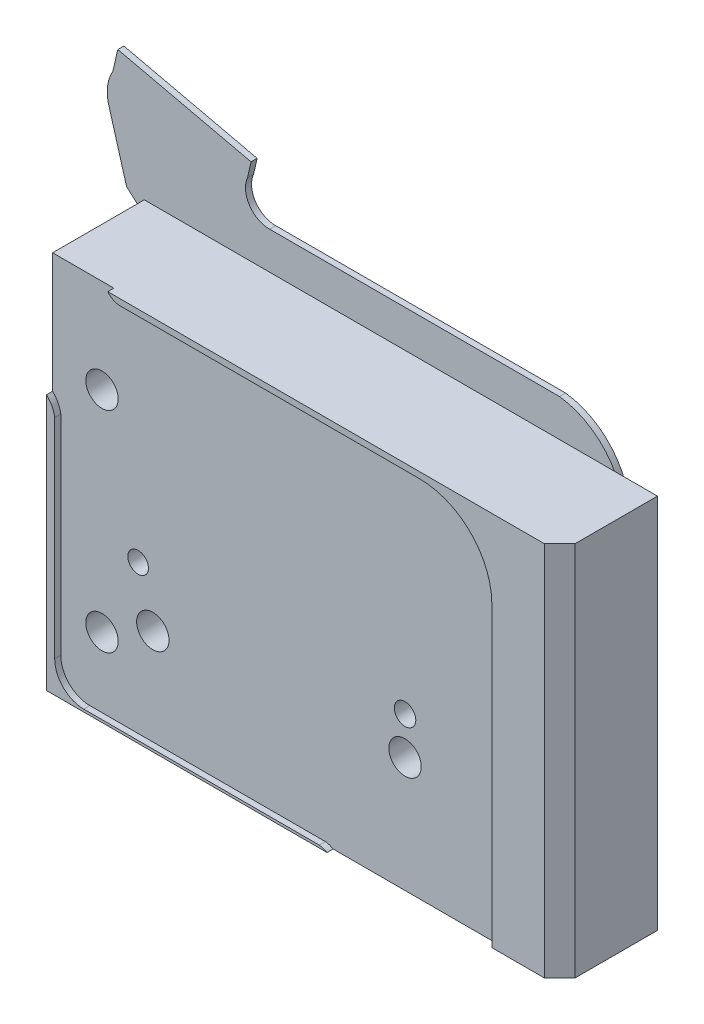
from build123d import *

# Parameters (mm, degrees)
CROQUIS1_R              = 4.430496459
CROQUIS1_R_2            = 2.021537648
CROQUIS1_R_3            = 2.872174668
CROQUIS1_R_4            = 2.680697474
CROQUIS1_R_5            = 2.776444448
CROQUIS1_R_6            = 2.106249137
CROQUIS1_R_7            = 2.790383016
SALIENTE_EXTRUIR1_DEPTH = 1.19
CROQUIS7_W              = 102.52
CROQUIS7_H              = 77.67
SALIENTE_EXTRUIR2_DEPTH = 19.15
CROQUIS8_R              = 2.021537648
CROQUIS8_R_2            = 3.175
CROQUIS8_R_3            = 2.106249137
CORTAR_EXTRUIR3_DEPTH   = 3107.825691909
CROQUIS8_7_R            = 2.856101073
CROQUIS8_7_R_2          = 2.872174668
CORTAR_EXTRUIR4_DEPTH   = 19.15
CROQUIS12_R             = 2.872174668
CROQUIS12_R_2           = 2.856101073
SALIENTE_EXTRUIR3_DEPTH = 7
CORTAR_EXTRUIR8_START   = -1.19
CROQUIS13_R             = 2.856101073
CROQUIS13_R_2           = 2.021537648
CROQUIS13_R_3           = 3.175
CROQUIS13_R_4           = 2.106249137
CROQUIS13_R_5           = 2.872174668
CORTAR_EXTRUIR8_DEPTH   = 1.19
CORTAR_EXTRUIR9_DEPTH   = 3107.825691909
CROQUIS15_R             = 3.175
CORTAR_EXTRUIR10_DEPTH  = 10.96
CHAFL_N1_SIZE           = 3


with BuildPart() as part:
    # Croquis1 → Saliente-Extruir1 (new body)
    with BuildSketch(Plane.XY):
        with BuildLine():
            Line((2788.515923591, 1163.062896503), (2845.320282862, 1163.062896503))
            ThreePointArc((2845.320282862, 1163.062896503), (2854.380265752, 1158.219977336), (2857.861371877, 1148.554623946))
            Line((2857.861371877, 1148.554623946), (2857.861371877, 1105.884683704))
            Line((2857.861371877, 1105.884683704), (2859.709564321, 1099.969499723))
            Line((2859.709564321, 1099.969499723), (2859.709564321, 1086.668463787))
            Line((2859.709564321, 1086.668463787), (2831.925019811, 1086.668463787))
            Line((2831.925019811, 1086.668463787), (2831.925019811, 1090.237043102))
            ThreePointArc((2831.925019811, 1090.237043102), (2830.339855276, 1092.909707682), (2827.46732338, 1094.094799688))
            Line((2827.46732338, 1094.094799688), (2781.073788136, 1094.094799688))
            ThreePointArc((2781.073788136, 1094.094799688), (2777.943377157, 1096.10205762), (2777.077273901, 1099.718467781))
            Line((2777.077273901, 1099.718467781), (2777.077273901, 1139.357764533))
            ThreePointArc((2777.077273901, 1139.357764533), (2776.16191908, 1141.931561181), (2774.31245647, 1143.941981956))
            Line((2774.31245647, 1143.941981956), (2760.508490421, 1156.27030536))
            Line((2760.508490421, 1156.27030536), (2756.869619555, 1168.884626052))
            ThreePointArc((2756.869619555, 1168.884626052), (2756.826740412, 1171.777711215), (2757.827792947, 1174.492425601))
            Line((2757.827792947, 1174.492425601), (2758.788780948, 1178.67068333))
            Line((2758.788780948, 1178.67068333), (2784.893128388, 1172.66675387))
            Line((2784.893128388, 1172.66675387), (2784.19129322, 1169.615260811))
            ThreePointArc((2784.19129322, 1169.615260811), (2784.56217485, 1165.156713392), (2788.515923591, 1163.062896503))
        make_face()
        with Locations((2819.601763615, 1133.235396685)):
            Circle(CROQUIS1_R, mode=Mode.SUBTRACT)
        with Locations((2790.727223865, 1121.638053324)):
            Circle(CROQUIS1_R_2, mode=Mode.SUBTRACT)
        with Locations((2783.65094449, 1147.375154376)):
            Circle(CROQUIS1_R_3, mode=Mode.SUBTRACT)
        with Locations((2793.607825607, 1111.419307874)):
            Circle(CROQUIS1_R_4, mode=Mode.SUBTRACT)
        with Locations((2783.65094449, 1106.253651095)):
            Circle(CROQUIS1_R_3, mode=Mode.SUBTRACT)
        with Locations((2842.913546585, 1132.266044758)):
            Circle(CROQUIS1_R_5, mode=Mode.SUBTRACT)
        with Locations((2843.009293559, 1122.033928625)):
            Circle(CROQUIS1_R_6, mode=Mode.SUBTRACT)
        with Locations((2843.009293559, 1114.670632569)):
            Circle(CROQUIS1_R_7, mode=Mode.SUBTRACT)
    extrude(amount=SALIENTE_EXTRUIR1_DEPTH)


with BuildPart() as body_2:
    # Croquis7 → Saliente-Extruir2 (new body)
    with BuildSketch(Plane.XY.offset(11.19)):
        with Locations((2823.237273901, 1128.929799688)):
            Rectangle(CROQUIS7_W, CROQUIS7_H)
    extrude(amount=SALIENTE_EXTRUIR2_DEPTH)

    # Croquis8 → Cortar-Extruir3 (cut, through all)
    with BuildSketch(Plane(origin=(0, 0, 11.19), x_dir=(-1, 0, 0), z_dir=(0, 0, -1))):
        with Locations((-2790.727223865, 1121.638053324)):
            Circle(CROQUIS8_R)
        with Locations((-2793.607825607, 1111.419307874)):
            Circle(CROQUIS8_R_2)
        with Locations((-2843.009293559, 1122.033928625)):
            Circle(CROQUIS8_R_3)
        with Locations((-2843.009293559, 1114.670632569)):
            Circle(CROQUIS8_R_2)
    extrude(amount=-CORTAR_EXTRUIR3_DEPTH, mode=Mode.SUBTRACT)

    # Croquis8<7> → Cortar-Extruir4 (cut)
    with BuildSketch(Plane(origin=(0, 0, 11.19), x_dir=(-1, 0, 0), z_dir=(0, 0, -1))):
        with Locations((-2783.65094449, 1106.253651095)):
            Circle(CROQUIS8_7_R)
        with Locations((-2783.65094449, 1147.375154376)):
            Circle(CROQUIS8_7_R_2)
    extrude(amount=-CORTAR_EXTRUIR4_DEPTH, mode=Mode.SUBTRACT)

    # Croquis12 → Saliente-Extruir3 (add)
    with BuildSketch(Plane(origin=(0, 0, 11.19), x_dir=(-1, 0, 0), z_dir=(0, 0, -1))):
        with Locations((-2783.65094449, 1147.375154376)):
            Circle(CROQUIS12_R)
        with Locations((-2783.65094449, 1106.253651095)):
            Circle(CROQUIS12_R_2)
    extrude(amount=-SALIENTE_EXTRUIR3_DEPTH)

    # Croquis13 → Cortar-Extruir8 (cut)
    # profile 1 of 3: a face of its own
    with BuildSketch(Plane.XY.offset(30.34).offset(CORTAR_EXTRUIR8_START)):
        with BuildLine():
            Line((2831.953626457, 1090.094799688), (2859.709564321, 1090.094799688))
            Line((2859.709564321, 1090.094799688), (2859.709564321, 1150.362896503))
            ThreePointArc((2859.709564321, 1150.362896503), (2855.989820443, 1159.343152624), (2847.009564321, 1163.062896503))
            Line((2847.009564321, 1163.062896503), (2788.515923591, 1163.062896503))
            ThreePointArc((2788.515923591, 1163.062896503), (2785.1646573, 1164.420153501), (2783.791167513, 1167.764799688))
            Line((2783.791167513, 1167.764799688), (2771.977273901, 1167.764799688))
            Line((2771.977273901, 1167.764799688), (2771.977273901, 1146.027533733))
            Line((2771.977273901, 1146.027533733), (2774.31245647, 1143.941981956))
            ThreePointArc((2774.31245647, 1143.941981956), (2776.16191908, 1141.931561181), (2777.077273901, 1139.357764533))
            Line((2777.077273901, 1139.357764533), (2777.077273901, 1098.284799688))
            ThreePointArc((2777.077273901, 1098.284799688), (2778.304496488, 1095.322022275), (2781.267273901, 1094.094799688))
            Line((2781.267273901, 1094.094799688), (2827.46732338, 1094.094799688))
            ThreePointArc((2827.46732338, 1094.094799688), (2830.394360406, 1092.86182908), (2831.953626457, 1090.094799688))
        make_face()
        with Locations(Location((2783.65094449, 1106.253651095, 0), (0, 0, 180))):
            Circle(CROQUIS13_R, mode=Mode.SUBTRACT)
        with Locations(Location((2790.727223865, 1121.638053324, 0), (0, 0, 180))):
            Circle(CROQUIS13_R_2, mode=Mode.SUBTRACT)
        with Locations(Location((2793.607825607, 1111.419307874, 0), (0, 0, 180))):
            Circle(CROQUIS13_R_3, mode=Mode.SUBTRACT)
        with Locations(Location((2843.009293559, 1114.670632569, 0), (0, 0, 180))):
            Circle(CROQUIS13_R_3, mode=Mode.SUBTRACT)
        with Locations(Location((2843.009293559, 1122.033928625, 0), (0, 0, 180))):
            Circle(CROQUIS13_R_4, mode=Mode.SUBTRACT)
        with Locations(Location((2783.65094449, 1147.375154376, 0), (0, 0, 180))):
            Circle(CROQUIS13_R_5, mode=Mode.SUBTRACT)
    # profile 2 of 3: a face of its own
    with BuildSketch(Plane.XY.offset(30.34).offset(CORTAR_EXTRUIR8_START)):
        with BuildLine():
            Line((2859.709564321, 1150.362896503), (2859.709564321, 1090.094799688))
            Line((2859.709564321, 1090.094799688), (2861.209564321, 1090.094799688))
            Line((2861.209564321, 1090.094799688), (2861.209564321, 1150.362896503))
            ThreePointArc((2861.209564321, 1150.362896503), (2857.050480614, 1160.403812796), (2847.009564321, 1164.562896503))
            Line((2847.009564321, 1164.562896503), (2788.504935412, 1164.562896503))
            ThreePointArc((2788.504935412, 1164.562896503), (2786.221426595, 1165.484692718), (2785.291247589, 1167.764799688))
            Line((2785.291247589, 1167.764799688), (2783.791167513, 1167.764799688))
            ThreePointArc((2783.791167513, 1167.764799688), (2785.1646573, 1164.420153501), (2788.515923591, 1163.062896503))
            Line((2788.515923591, 1163.062896503), (2847.009564321, 1163.062896503))
            ThreePointArc((2847.009564321, 1163.062896503), (2855.989820443, 1159.343152624), (2859.709564321, 1150.362896503))
        make_face()
    # profile 3 of 3: a face of its own
    with BuildSketch(Plane.XY.offset(30.34).offset(CORTAR_EXTRUIR8_START)):
        with BuildLine():
            Line((2830.41617467, 1090.094799688), (2831.953626457, 1090.094799688))
            ThreePointArc((2831.953626457, 1090.094799688), (2830.394360406, 1092.86182908), (2827.46732338, 1094.094799688))
            Line((2827.46732338, 1094.094799688), (2781.267273901, 1094.094799688))
            ThreePointArc((2781.267273901, 1094.094799688), (2778.304496488, 1095.322022275), (2777.077273901, 1098.284799688))
            Line((2777.077273901, 1098.284799688), (2777.077273901, 1139.357764533))
            ThreePointArc((2777.077273901, 1139.357764533), (2776.16191908, 1141.931561181), (2774.31245647, 1143.941981956))
            Line((2774.31245647, 1143.941981956), (2771.977273901, 1146.027533733))
            Line((2771.977273901, 1146.027533733), (2771.977273901, 1144.016399101))
            Line((2771.977273901, 1144.016399101), (2773.374482197, 1142.768552238))
            ThreePointArc((2773.374482197, 1142.768552238), (2774.832525087, 1141.230026801), (2775.577273901, 1139.245512051))
            Line((2775.577273901, 1139.245512051), (2775.577273901, 1098.284799688))
            ThreePointArc((2775.577273901, 1098.284799688), (2777.243836316, 1094.261362103), (2781.267273901, 1092.594799688))
            Line((2781.267273901, 1092.594799688), (2827.41067607, 1092.594799688))
            ThreePointArc((2827.41067607, 1092.594799688), (2829.307496614, 1091.818551917), (2830.41617467, 1090.094799688))
        make_face()
    extrude(amount=CORTAR_EXTRUIR8_DEPTH, mode=Mode.SUBTRACT)

    # Croquis14 → Cortar-Extruir9 (cut, through all)
    with BuildSketch(Plane(origin=(0, 0, 11.19), x_dir=(-1, 0, 0), z_dir=(0, 0, -1))):
        Polygon((-2773.977273901, 1165.764799688), (-2773.977273901, 1092.094799688), (-2874.497273901, 1092.094799688), (-2874.497273901, 1090.094799688), (-2771.977273901, 1090.094799688), (-2771.977273901, 1167.764799688), (-2874.497273901, 1167.764799688), (-2874.497273901, 1165.764799688), align=None)
    extrude(amount=-CORTAR_EXTRUIR9_DEPTH, mode=Mode.SUBTRACT)

    # Croquis15 → Cortar-Extruir10 (cut)
    with BuildSketch(Plane.XY.offset(29.15)):
        with Locations((2783.65094449, 1147.375154376)):
            Circle(CROQUIS15_R)
        with Locations((2783.65094449, 1106.253651095)):
            Circle(CROQUIS15_R)
    extrude(amount=-CORTAR_EXTRUIR10_DEPTH, mode=Mode.SUBTRACT)

    # Chaflán1
    chafl_n1_edges = [body_2.edges().sort_by_distance(p)[0] for p in [
        (2874.497273901, 1128.929799688, 30.34),
    ]]
    chamfer(chafl_n1_edges, length=CHAFL_N1_SIZE)


solid = Compound([part.part, body_2.part])
